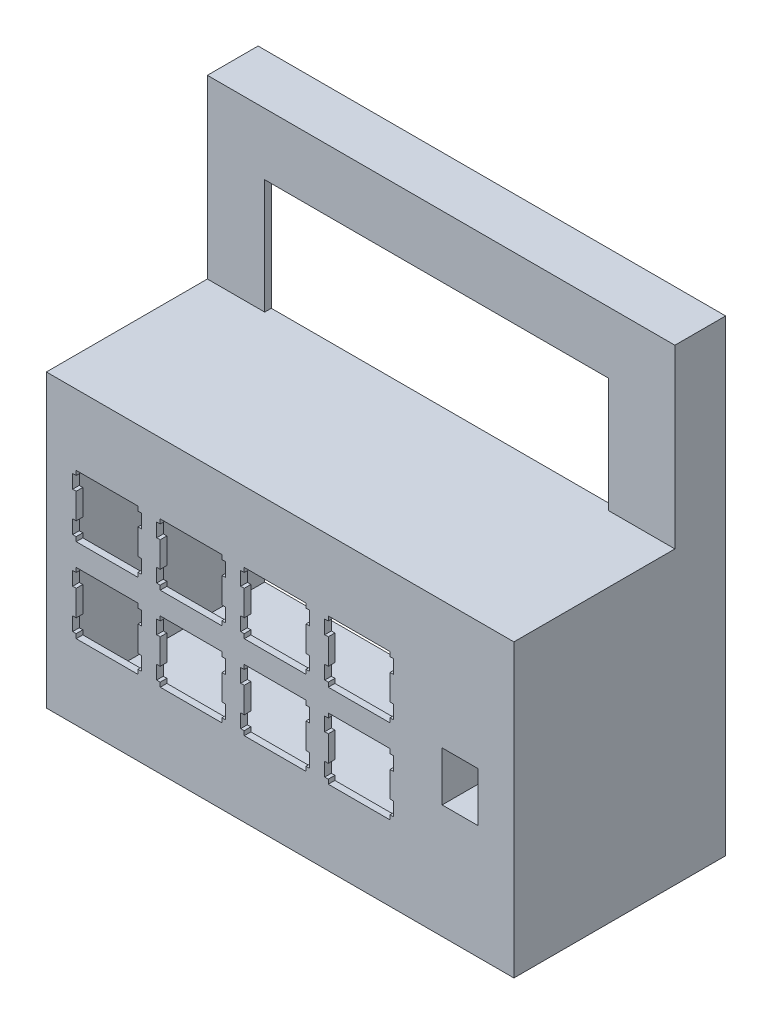
from build123d import *

# Parameters (mm, degrees)
SKETCH_1_W          = 106
SKETCH_1_H          = 40
EXTRUDE_1_DEPTH     = 1.5
SKETCH_5_W          = 106
SKETCH_5_H          = 36.5
EXTRUDE_4_DEPTH     = 1.5
SKETCH_6_W          = 106
SKETCH_6_H          = 66
EXTRUDE_5_DEPTH     = 1.5
EXTRUDE_6_DEPTH     = 10
EXTRUDE_7_DEPTH     = 46.5
SKETCH_11_W         = 8.1
SKETCH_11_H         = 11.2
CUT_EXTRUDE_1_DEPTH = 1.5
SKETCH_12_W         = 11.1
SKETCH_12_H         = 14.2
SKETCH_12_W_2       = 8.1
SKETCH_12_H_2       = 11.2
EXTRUDE_8_DEPTH     = 10
SKETCH_13_W         = 78
SKETCH_13_H         = 26
CUT_EXTRUDE_2_DEPTH = 1.5


with BuildPart() as part:
    # 草图1 → 凸台-拉伸1 (new body)
    with BuildSketch(Plane.XY):
        with Locations((53, -20)):
            Rectangle(SKETCH_1_W, SKETCH_1_H)
    extrude(amount=EXTRUDE_1_DEPTH)

    # 草图5 → 凸台-拉伸4 (add)
    with BuildSketch(Plane.XZ.offset(40)):
        with Locations((53, 18.25)):
            Rectangle(SKETCH_5_W, SKETCH_5_H)
    extrude(amount=EXTRUDE_4_DEPTH)

    # 草图6 → 凸台-拉伸5 (add)
    with BuildSketch(Plane.XY.offset(36.5)):
        with Locations((53, -73)):
            Rectangle(SKETCH_6_W, SKETCH_6_H)
    extrude(amount=EXTRUDE_5_DEPTH)

    # 草图7 → 凸台-拉伸6 (add)
    with BuildSketch(Plane(origin=(0, 0, 0), x_dir=(-1, 0, 0), z_dir=(0, 0, -1))):
        Polygon((-106, -41.5), (-106, 0), (0, 0), (0, -41.5), (-1.5, -41.5), (-1.5, -1.5), (-104.5, -1.5), (-104.5, -41.5), align=None)
    extrude(amount=EXTRUDE_6_DEPTH)

    # 草图8 → 凸台-拉伸7 (add)
    with BuildSketch(Plane(origin=(0, 0, 36.5), x_dir=(-1, 0, 0), z_dir=(0, 0, -1))):
        Polygon((-106, -41.5), (-106, -106), (0, -106), (0, -41.5), (-1.5, -41.5), (-1.5, -104.5), (-104.5, -104.5), (-104.5, -41.5), align=None)
    extrude(amount=EXTRUDE_7_DEPTH)

    # 草图11 → 切除-拉伸1 (cut)
    with BuildSketch(Plane.XY.offset(38)):
        Polygon((63.911237552, -74.99759487), (63.911237552, -75.99809487), (63.110437552, -75.99809487), (63.110437552, -79.09729487), (63.911237552, -79.09729487), (63.911237552, -84.89729487), (63.110437552, -84.89729487), (63.110437552, -87.99789487), (63.911237552, -87.99789487), (63.911237552, -88.99829487), (77.910537552, -88.99829487), (77.910537552, -87.99789487), (78.711337552, -87.99789487), (78.711337552, -84.89729487), (77.910537552, -84.89729487), (77.910537552, -79.09729487), (78.711337552, -79.09729487), (78.711337552, -75.99809487), (77.910537552, -75.99809487), (77.910537552, -74.99759487), align=None)
        Polygon((44.861237552, -74.99759487), (44.861237552, -75.99809487), (44.060437552, -75.99809487), (44.060437552, -79.09729487), (44.861237552, -79.09729487), (44.861237552, -84.89729487), (44.060437552, -84.89729487), (44.060437552, -87.99789487), (44.861237552, -87.99789487), (44.861237552, -88.99829487), (58.860537552, -88.99829487), (58.860537552, -87.99789487), (59.661337552, -87.99789487), (59.661337552, -84.89729487), (58.860537552, -84.89729487), (58.860537552, -79.09729487), (59.661337552, -79.09729487), (59.661337552, -75.99809487), (58.860537552, -75.99809487), (58.860537552, -74.99759487), align=None)
        Polygon((25.811237552, -74.99759487), (25.811237552, -75.99809487), (25.010537552, -75.99809487), (25.010537552, -79.09729487), (25.811237552, -79.09729487), (25.811237552, -84.89729487), (25.010537552, -84.89729487), (25.010537552, -87.99789487), (25.811237552, -87.99789487), (25.811237552, -88.99829487), (39.810537552, -88.99829487), (39.810537552, -87.99789487), (40.611337552, -87.99789487), (40.611337552, -84.89729487), (39.810537552, -84.89729487), (39.810537552, -79.09729487), (40.611337552, -79.09729487), (40.611337552, -75.99809487), (39.810537552, -75.99809487), (39.810537552, -74.99759487), align=None)
        Polygon((6.761187552, -74.99759487), (6.761187552, -75.99809487), (5.960547552, -75.99809487), (5.960547552, -79.09729487), (6.761187552, -79.09729487), (6.761187552, -84.89729487), (5.960547552, -84.89729487), (5.960547552, -87.99789487), (6.761187552, -87.99789487), (6.761187552, -88.99829487), (20.760737552, -88.99829487), (20.760737552, -87.99789487), (21.561337552, -87.99789487), (21.561337552, -84.89729487), (20.760737552, -84.89729487), (20.760737552, -79.09729487), (21.561337552, -79.09729487), (21.561337552, -75.99809487), (20.760737552, -75.99809487), (20.760737552, -74.99759487), align=None)
        Polygon((63.911237552, -55.94899487), (63.911237552, -56.94949487), (63.110437552, -56.94949487), (63.110437552, -60.04869487), (63.911237552, -60.04869487), (63.911237552, -65.84869487), (63.110437552, -65.84869487), (63.110437552, -68.94929487), (63.911237552, -68.94929487), (63.911237552, -69.94829487), (77.910537552, -69.94829487), (77.910537552, -68.94929487), (78.711337552, -68.94929487), (78.711337552, -65.84869487), (77.910537552, -65.84869487), (77.910537552, -60.04869487), (78.711337552, -60.04869487), (78.711337552, -56.94949487), (77.910537552, -56.94949487), (77.910537552, -55.94899487), align=None)
        Polygon((44.861237552, -55.94899487), (44.861237552, -56.94949487), (44.060437552, -56.94949487), (44.060437552, -60.04869487), (44.861237552, -60.04869487), (44.861237552, -65.84869487), (44.060437552, -65.84869487), (44.060437552, -68.94929487), (44.861237552, -68.94929487), (44.861237552, -69.94829487), (58.860537552, -69.94829487), (58.860537552, -68.94929487), (59.661337552, -68.94929487), (59.661337552, -65.84869487), (58.860537552, -65.84869487), (58.860537552, -60.04869487), (59.661337552, -60.04869487), (59.661337552, -56.94949487), (58.860537552, -56.94949487), (58.860537552, -55.94899487), align=None)
        Polygon((25.811237552, -55.94899487), (25.811237552, -56.94949487), (25.010537552, -56.94949487), (25.010537552, -60.04869487), (25.811237552, -60.04869487), (25.811237552, -65.84869487), (25.010537552, -65.84869487), (25.010537552, -68.94929487), (25.811237552, -68.94929487), (25.811237552, -69.94829487), (39.810537552, -69.94829487), (39.810537552, -68.94929487), (40.611337552, -68.94929487), (40.611337552, -65.84869487), (39.810537552, -65.84869487), (39.810537552, -60.04869487), (40.611337552, -60.04869487), (40.611337552, -56.94949487), (39.810537552, -56.94949487), (39.810537552, -55.94899487), align=None)
        Polygon((6.761187552, -55.94899487), (6.761187552, -56.94949487), (5.960547552, -56.94949487), (5.960547552, -60.04869487), (6.761187552, -60.04869487), (6.761187552, -65.84869487), (5.960547552, -65.84869487), (5.960547552, -68.94929487), (6.761187552, -68.94929487), (6.761187552, -69.94829487), (20.760737552, -69.94829487), (20.760737552, -68.94929487), (21.561337552, -68.94929487), (21.561337552, -65.84869487), (20.760737552, -65.84869487), (20.760737552, -60.04869487), (21.561337552, -60.04869487), (21.561337552, -56.94949487), (20.760737552, -56.94949487), (20.760737552, -55.94899487), align=None)
        with Locations((93.785079963, -74.54929487)):
            Rectangle(SKETCH_11_W, SKETCH_11_H)
    extrude(amount=-CUT_EXTRUDE_1_DEPTH, mode=Mode.SUBTRACT)

    # 草图12 → 凸台-拉伸8 (add)
    with BuildSketch(Plane(origin=(0, 0, 36.5), x_dir=(-1, 0, 0), z_dir=(0, 0, -1))):
        with Locations((-93.785079963, -74.54929487)):
            Rectangle(SKETCH_12_W, SKETCH_12_H)
        with Locations((-93.785079963, -74.54929487)):
            Rectangle(SKETCH_12_W_2, SKETCH_12_H_2, mode=Mode.SUBTRACT)
    extrude(amount=EXTRUDE_8_DEPTH)

    # 草图13 → 切除-拉伸2 (cut)
    with BuildSketch(Plane.XY.offset(1.5)):
        with Locations((52, -27)):
            Rectangle(SKETCH_13_W, SKETCH_13_H)
    extrude(amount=-CUT_EXTRUDE_2_DEPTH, mode=Mode.SUBTRACT)


solid = part.part
